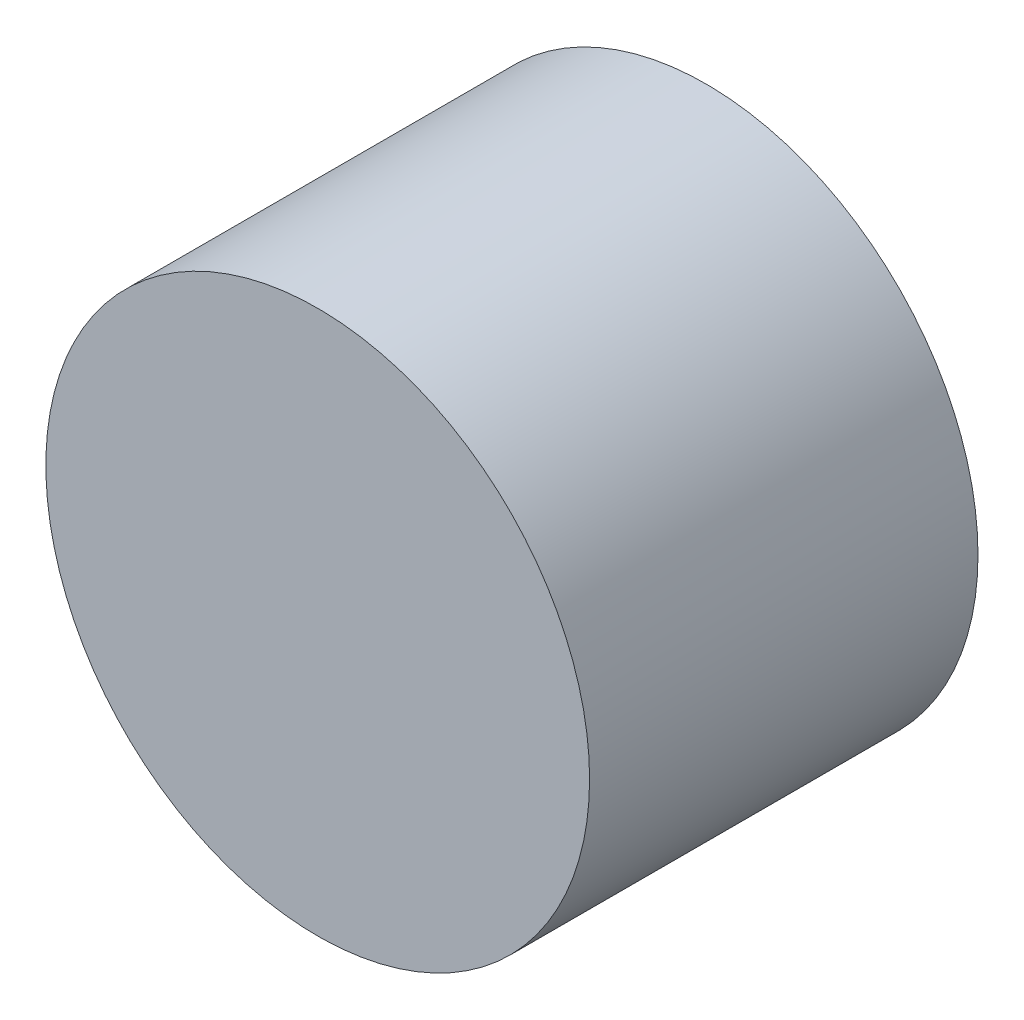
from build123d import *

# Parameters (mm, degrees)
SKIZZE1_R                       = 3.5
AUFSATZ_LINEAR_AUSTRAGEN1_DEPTH = 5


with BuildPart() as part:
    # Skizze1 → Aufsatz-Linear austragen1 (new body)
    with BuildSketch(Plane.XY):
        Circle(SKIZZE1_R)
    extrude(amount=AUFSATZ_LINEAR_AUSTRAGEN1_DEPTH)


solid = part.part
